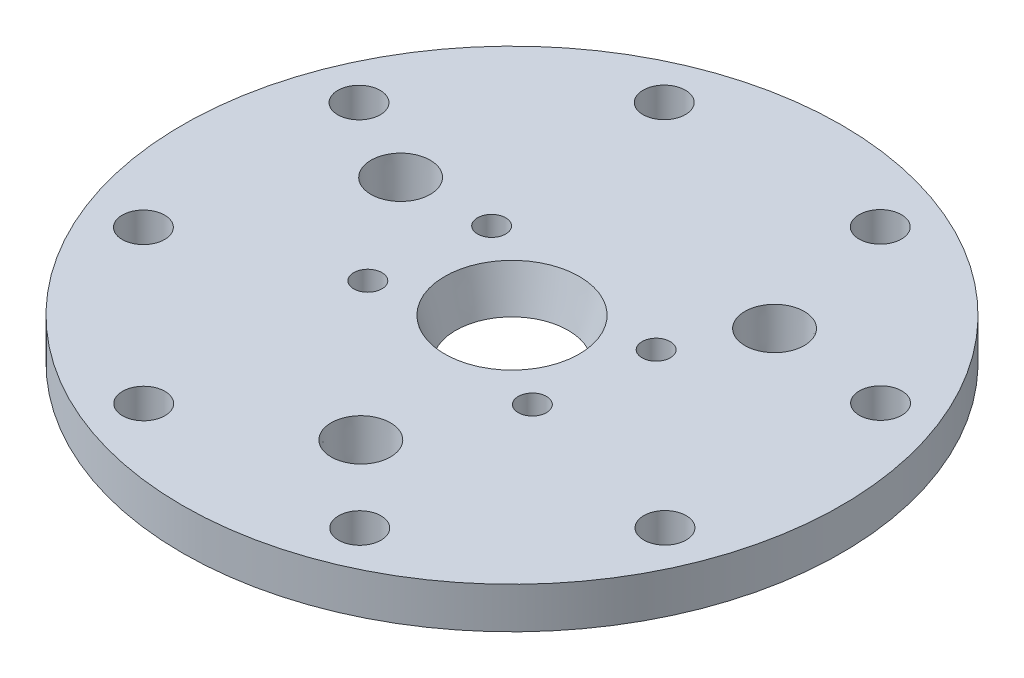
from build123d import *

# Parameters (mm, degrees)
SKETCH1_R               = 76.2
BOSS_EXTRUDE1_DEPTH     = 9.525
CIRPATTERN6_COUNT       = 3
F_3_8_CLEARANCE_HOLE1_D = 9.8044
F_1_4_CLEARANCE_HOLE1_D = 6.5278


with BuildPart() as part:
    # Sketch1 → Boss-Extrude1 (new body)
    with BuildSketch(Plane(origin=(0, 0, 0), x_dir=(1, 0, 0), z_dir=(0, 1, 0))):
        with Locations(Location((0, 0, 0), (0, 0, 90))):
            Circle(SKETCH1_R)
    extrude(amount=BOSS_EXTRUDE1_DEPTH)

    # Sketch5 → Cut-Revolve1 (revolve, cut)
    with BuildSketch(Plane.XY, mode=Mode.PRIVATE) as cut_revolve1_sk:
        Polygon((0, 0), (0, 9.525), (15.552216058, 9.525), (13, 0), align=None)
    revolve(cut_revolve1_sk.sketch.rotate(Axis((0, 0, 0), (0, 1, 0)), 90), axis=Axis((0, 0, 0), (0, 1, 0)), mode=Mode.SUBTRACT)

    # Sketch15 → 1/4 NPT Tapped Hole1 (revolve, cut)
    with BuildSketch(Plane(origin=(33.011727721, 9.525, -27.700128555), x_dir=(0, 0, 1), z_dir=(1, 0, 0))):
        Polygon((0, 0), (0, 9.525), (5.5626, 9.525), (5.5626, 10.0203), (6.557978799, 10.0203), (6.858, 0), align=None)
    f_1_4_npt_tapped_hole1 = revolve(axis=Axis((33.011727721, 15.875, -27.700128555), (0, -1, 0)), mode=Mode.SUBTRACT)

    # CirPattern6: 1/4 NPT Tapped Hole1 ×3 about axis
    cirpattern6_axis = Axis((0, 0, 0), (0, 1, 0))
    for i in range(1, CIRPATTERN6_COUNT):
        add(f_1_4_npt_tapped_hole1.rotate(cirpattern6_axis, i * 360 / CIRPATTERN6_COUNT), mode=Mode.SUBTRACT)

    # 3/8 Clearance Hole1 (through all)
    with Locations(Plane(origin=(0, 9.525, 0), x_dir=(1, 0, 0), z_dir=(0, 1, 0))):
        with Locations((60.207217661, 25.013604371), (60.257374801, -24.888494705), (24.885638551, 60.264250563), (-25.016460514, 60.214093421), (-60.267106699, 24.892514335), (-60.216949569, -25.009584719), (-24.895370482, -60.260230921), (25.006728592, -60.210073801)):
            Hole(F_3_8_CLEARANCE_HOLE1_D / 2)

    # 1/4 Clearance Hole1 (through all)
    with Locations(Plane(origin=(0, 9.525, 0), x_dir=(1, 0, 0), z_dir=(0, 1, 0))):
        with Locations((-20.240427094, 15.531025958), (20.240427094, -15.531025958), (-23.570476573, -9.763211068), (23.570476573, 9.763211068)):
            Hole(F_1_4_CLEARANCE_HOLE1_D / 2)


solid = part.part
